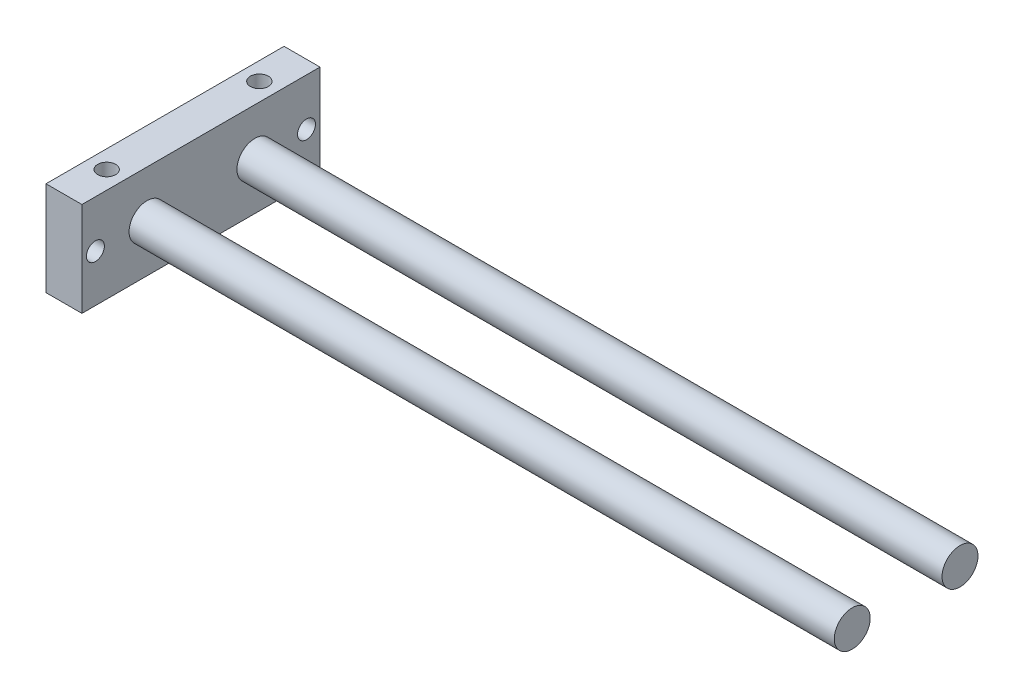
from build123d import *

# Parameters (mm, degrees)
SKETCH_1_W          = 53
SKETCH_1_H          = 21
SKETCH_1_R          = 2
EXTRUDE_1_DEPTH     = 8
SKETCH_2_R          = 4
CUT_EXTRUDE_1_DEPTH = 5
SKETCH_3_R          = 4
EXTRUDE_2_DEPTH     = 157
SKETCH_4_R          = 2
CUT_EXTRUDE_2_DEPTH = 5


with BuildPart() as part:
    # 草图1 → 凸台-拉伸1 (new body)
    with BuildSketch(Plane(origin=(0, 0, 0), x_dir=(0, 0, -1), z_dir=(1, 0, 0))):
        with Locations((26.5, 10.5)):
            Rectangle(SKETCH_1_W, SKETCH_1_H)
        with Locations((50, 10.5)):
            Circle(SKETCH_1_R, mode=Mode.SUBTRACT)
        with Locations(Location((3, 10.5, 0), (0, 0, 180))):
            Circle(SKETCH_1_R, mode=Mode.SUBTRACT)
    extrude(amount=EXTRUDE_1_DEPTH)

    # 草图2 → 切除-拉伸1 (cut)
    with BuildSketch(Plane.ZY):
        with Locations((-14.5, 10.5)):
            Circle(SKETCH_2_R)
        with Locations(Location((-38.5, 10.5, 0), (0, 0, 180))):
            Circle(SKETCH_2_R)
    extrude(amount=-CUT_EXTRUDE_1_DEPTH, mode=Mode.SUBTRACT)

    # 草图3 → 凸台-拉伸2 (add)
    with BuildSketch(Plane(origin=(8, 0, 0), x_dir=(0, 0, -1), z_dir=(1, 0, 0))):
        with Locations((38.5, 10.5)):
            Circle(SKETCH_3_R)
        with Locations(Location((14.5, 10.5, 0), (0, 0, 180))):
            Circle(SKETCH_3_R)
    extrude(amount=EXTRUDE_2_DEPTH)

    # 草图4 → 切除-拉伸2 (cut)
    with BuildSketch(Plane(origin=(0, 21, 0), x_dir=(1, 0, 0), z_dir=(0, 1, 0))):
        with Locations(Location((4, 43.5, 0), (0, 0, 270))):
            Circle(SKETCH_4_R)
        with Locations(Location((4, 9.5, 0), (0, 0, 90))):
            Circle(SKETCH_4_R)
    extrude(amount=-CUT_EXTRUDE_2_DEPTH, mode=Mode.SUBTRACT)


solid = part.part
